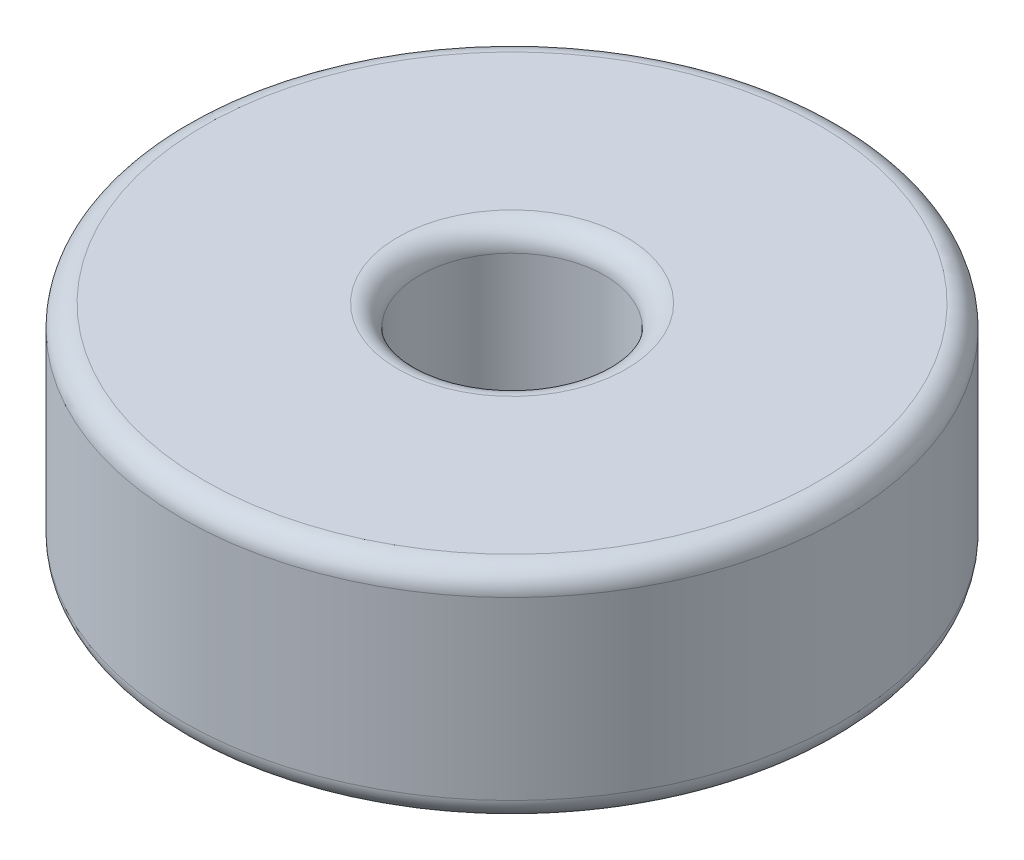
from build123d import *

# Parameters (mm, degrees)
SKETCH1_R           = 7.5
SKETCH1_R_2         = 2.1
BOSS_EXTRUDE1_DEPTH = 5
FILLET1_R           = 0.5


with BuildPart() as part:
    # Sketch1 → Boss-Extrude1 (new body)
    with BuildSketch(Plane(origin=(0, 0, 0), x_dir=(1, 0, 0), z_dir=(0, 1, 0))):
        with Locations(Location((0, 0, 0), (0, 0, 270))):
            Circle(SKETCH1_R)
        with Locations(Location((0, 0, 0), (0, 0, 270))):
            Circle(SKETCH1_R_2, mode=Mode.SUBTRACT)
    extrude(amount=BOSS_EXTRUDE1_DEPTH)

    # Fillet1
    fillet1_edges = [part.edges().sort_by_distance(p)[0] for p in [
        (0, 0, -7.5),
        (0, 5, -7.5),
        (0, 0, -2.1),
        (0, 5, -2.1),
    ]]
    fillet(fillet1_edges, radius=FILLET1_R)


solid = part.part
